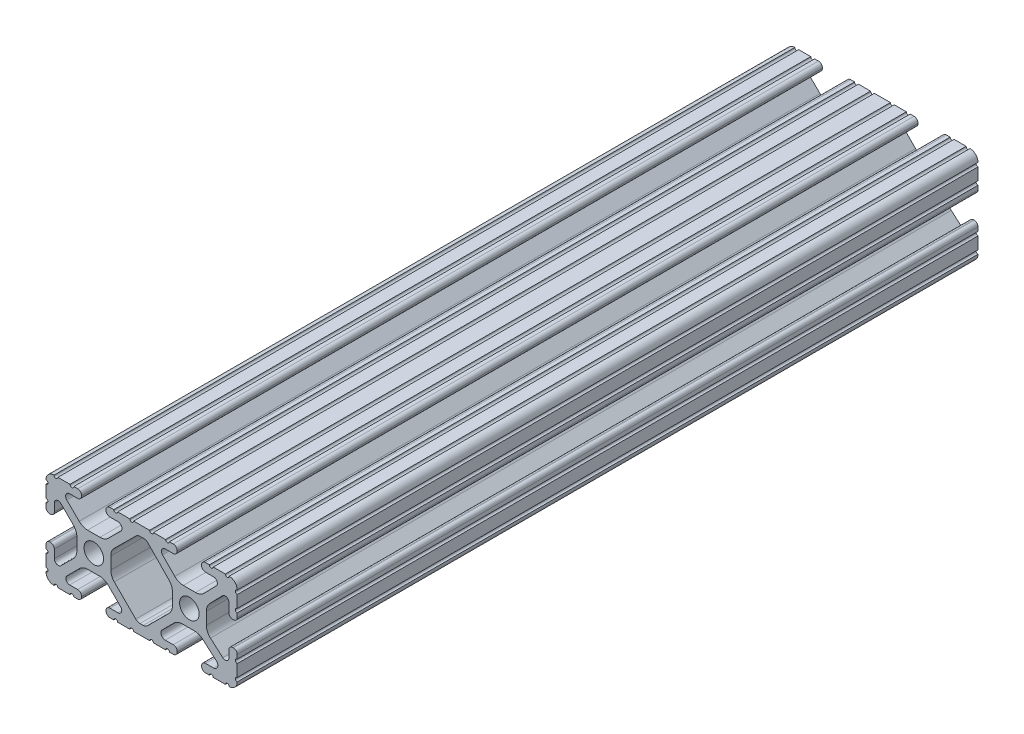
from build123d import *

# Parameters (mm, degrees)
SKETCH1_R           = 2.6035
BOSS_EXTRUDE1_DEPTH = 98.425


with BuildPart() as part:
    # Sketch1 → Boss-Extrude1 (new, symmetric)
    with BuildSketch(Plane.XY):
        with BuildLine():
            Line((18.01710265, 12.7), (16.98745015, 12.7))
            ThreePointArc((16.98745015, 12.7), (16.245730386, 12.392769614), (15.9385, 11.65104985))
            Line((15.9385, 11.65104985), (15.9385, 11.53922))
            ThreePointArc((15.9385, 11.53922), (16.245750844, 10.797450844), (16.98752, 10.4902))
            Line((16.98752, 10.4902), (19.116384363, 10.4902))
            ThreePointArc((19.116384363, 10.4902), (20.052502933, 9.869096983), (19.844087081, 8.765172272))
            Line((19.844087081, 8.765172272), (16.618993479, 5.455112286))
            ThreePointArc((16.618993479, 5.455112286), (15.578994274, 4.745442459), (14.344932584, 4.4958))
            Line((14.344932584, 4.4958), (11.083317835, 4.4958))
            ThreePointArc((11.083317835, 4.4958), (9.854330953, 4.743306833), (8.816955189, 5.447238587))
            Line((8.816955189, 5.447238587), (5.564154119, 8.762652677))
            ThreePointArc((5.564154119, 8.762652677), (5.352591412, 9.867473037), (6.289393385, 10.4902))
            Line((6.289393385, 10.4902), (8.41248, 10.4902))
            ThreePointArc((8.41248, 10.4902), (9.154249156, 10.797450844), (9.4615, 11.53922))
            Line((9.4615, 11.53922), (9.4615, 11.65104985))
            ThreePointArc((9.4615, 11.65104985), (9.154269614, 12.392769614), (8.41254985, 12.7))
            Line((8.41254985, 12.7), (7.38288465, 12.7))
            ThreePointArc((7.38288465, 12.7), (6.87488465, 12.192), (6.36688465, 12.7))
            Line((6.36688465, 12.7), (3.14958095, 12.7))
            ThreePointArc((3.14958095, 12.7), (2.64158095, 12.192), (2.13358095, 12.7))
            Line((2.13358095, 12.7), (-2.13358095, 12.7))
            ThreePointArc((-2.13358095, 12.7), (-2.64158095, 12.192), (-3.14958095, 12.7))
            Line((-3.14958095, 12.7), (-6.36689735, 12.7))
            ThreePointArc((-6.36689735, 12.7), (-6.87489735, 12.192), (-7.38289735, 12.7))
            Line((-7.38289735, 12.7), (-8.41254985, 12.7))
            ThreePointArc((-8.41254985, 12.7), (-9.154269614, 12.392769614), (-9.4615, 11.65104985))
            Line((-9.4615, 11.65104985), (-9.4615, 11.53922))
            ThreePointArc((-9.4615, 11.53922), (-9.154249156, 10.797450844), (-8.41248, 10.4902))
            Line((-8.41248, 10.4902), (-6.283641037, 10.4902))
            ThreePointArc((-6.283641037, 10.4902), (-5.297291557, 9.829633109), (-5.532576693, 8.666071843))
            Line((-5.532576693, 8.666071843), (-8.809985098, 5.416263103))
            ThreePointArc((-8.809985098, 5.416263103), (-9.836720513, 4.734920264), (-11.045536121, 4.4958))
            Line((-11.045536121, 4.4958), (-14.354463879, 4.4958))
            ThreePointArc((-14.354463879, 4.4958), (-15.563279487, 4.734920264), (-16.590014902, 5.416263103))
            Line((-16.590014902, 5.416263103), (-19.867423307, 8.666071843))
            ThreePointArc((-19.867423307, 8.666071843), (-20.102708443, 9.829633109), (-19.116358963, 10.4902))
            Line((-19.116358963, 10.4902), (-16.98752, 10.4902))
            ThreePointArc((-16.98752, 10.4902), (-16.245750844, 10.797450844), (-15.9385, 11.53922))
            Line((-15.9385, 11.53922), (-15.9385, 11.65104985))
            ThreePointArc((-15.9385, 11.65104985), (-16.245730386, 12.392769614), (-16.98745015, 12.7))
            Line((-16.98745015, 12.7), (-18.01711535, 12.7))
            ThreePointArc((-18.01711535, 12.7), (-18.52511535, 12.192), (-19.03311535, 12.7))
            Line((-19.03311535, 12.7), (-22.2504, 12.7))
            ThreePointArc((-22.2504, 12.7), (-22.758323491, 12.192000006), (-23.266399977, 12.699846982))
            ThreePointArc((-23.266399977, 12.699846982), (-24.782522516, 12.082522516), (-25.399846982, 10.566399977))
            ThreePointArc((-25.399846982, 10.566399977), (-24.892000006, 10.058323491), (-25.4, 9.5504))
            Line((-25.4, 9.5504), (-25.4, 6.3330836))
            ThreePointArc((-25.4, 6.3330836), (-24.892, 5.8250836), (-25.4, 5.3170836))
            Line((-25.4, 5.3170836), (-25.4, 4.237520184))
            ThreePointArc((-25.4, 4.237520184), (-25.107393763, 3.531106237), (-24.400979816, 3.2385))
            Line((-24.400979816, 3.2385), (-24.23922, 3.2385))
            ThreePointArc((-24.23922, 3.2385), (-23.497450844, 3.545750844), (-23.1902, 4.28752))
            Line((-23.1902, 4.28752), (-23.1902, 6.334741132))
            ThreePointArc((-23.1902, 6.334741132), (-22.556026952, 7.286023527), (-21.434002553, 7.066535717))
            Line((-21.434002553, 7.066535717), (-18.147950853, 3.808156468))
            ThreePointArc((-18.147950853, 3.808156468), (-17.452759693, 2.774838327), (-17.208501877, 1.553619571))
            Line((-17.208501877, 1.553619571), (-17.208501877, -1.695179196))
            ThreePointArc((-17.208501877, -1.695179196), (-17.450738657, -2.911536421), (-18.140486065, -3.942289578))
            Line((-18.140486065, -3.942289578), (-21.431579576, -7.227386226))
            ThreePointArc((-21.431579576, -7.227386226), (-22.55444896, -7.449940594), (-23.1902, -6.498002195))
            Line((-23.1902, -6.498002195), (-23.1902, -4.28752))
            ThreePointArc((-23.1902, -4.28752), (-23.497450844, -3.545750844), (-24.23922, -3.2385))
            Line((-24.23922, -3.2385), (-24.35098, -3.2385))
            ThreePointArc((-24.35098, -3.2385), (-25.092749156, -3.545750844), (-25.4, -4.28752))
            Line((-25.4, -4.28752), (-25.4, -5.3171344))
            ThreePointArc((-25.4, -5.3171344), (-24.892, -5.8251344), (-25.4, -6.3331344))
            Line((-25.4, -6.3331344), (-25.4, -9.5504))
            ThreePointArc((-25.4, -9.5504), (-24.892000006, -10.058323491), (-25.399846982, -10.566399977))
            ThreePointArc((-25.399846982, -10.566399977), (-24.782522516, -12.082522516), (-23.266399977, -12.699846982))
            ThreePointArc((-23.266399977, -12.699846982), (-22.758323491, -12.192000006), (-22.2504, -12.7))
            Line((-22.2504, -12.7), (-19.03308995, -12.7))
            ThreePointArc((-19.03308995, -12.7), (-18.52508995, -12.192), (-18.01708995, -12.7))
            Line((-18.01708995, -12.7), (-16.9874692, -12.7))
            ThreePointArc((-16.9874692, -12.7), (-16.245700044, -12.392749156), (-15.9384492, -11.65098))
            Line((-15.9384492, -11.65098), (-15.9384492, -11.53922))
            ThreePointArc((-15.9384492, -11.53922), (-16.245700044, -10.797450844), (-16.9874692, -10.4902))
            Line((-16.9874692, -10.4902), (-19.116358963, -10.4902))
            ThreePointArc((-19.116358963, -10.4902), (-20.055197748, -9.862578342), (-19.834124023, -8.755124678))
            Line((-19.834124023, -8.755124678), (-16.49660751, -5.423689618))
            ThreePointArc((-16.49660751, -5.423689618), (-15.467274017, -4.736928798), (-14.253591699, -4.4958))
            Line((-14.253591699, -4.4958), (-11.146408301, -4.4958))
            ThreePointArc((-11.146408301, -4.4958), (-9.932725983, -4.736928798), (-8.90339249, -5.423689618))
            Line((-8.90339249, -5.423689618), (-5.565875977, -8.755124678))
            ThreePointArc((-5.565875977, -8.755124678), (-5.344802252, -9.862578342), (-6.283641037, -10.4902))
            Line((-6.283641037, -10.4902), (-8.4125308, -10.4902))
            ThreePointArc((-8.4125308, -10.4902), (-9.154299956, -10.797450844), (-9.4615508, -11.53922))
            Line((-9.4615508, -11.53922), (-9.4615508, -11.65098))
            ThreePointArc((-9.4615508, -11.65098), (-9.154299956, -12.392749156), (-8.4125308, -12.7))
            Line((-8.4125308, -12.7), (-7.38287195, -12.7))
            ThreePointArc((-7.38287195, -12.7), (-6.87487195, -12.192), (-6.36687195, -12.7))
            Line((-6.36687195, -12.7), (-3.14960635, -12.7))
            ThreePointArc((-3.14960635, -12.7), (-2.64160635, -12.192), (-2.13360635, -12.7))
            Line((-2.13360635, -12.7), (2.13360635, -12.7))
            ThreePointArc((2.13360635, -12.7), (2.64159365, -12.1920127), (3.14958095, -12.7))
            Line((3.14958095, -12.7), (6.36691005, -12.7))
            ThreePointArc((6.36691005, -12.7), (6.87491005, -12.192), (7.38291005, -12.7))
            Line((7.38291005, -12.7), (8.4125308, -12.7))
            ThreePointArc((8.4125308, -12.7), (9.154299956, -12.392749156), (9.4615508, -11.65098))
            Line((9.4615508, -11.65098), (9.4615508, -11.53922))
            ThreePointArc((9.4615508, -11.53922), (9.154299956, -10.797450844), (8.4125308, -10.4902))
            Line((8.4125308, -10.4902), (6.289393385, -10.4902))
            ThreePointArc((6.289393385, -10.4902), (5.231590322, -9.783049717), (5.480677245, -8.535265862))
            Line((5.480677245, -8.535265862), (8.597933595, -5.423689618))
            ThreePointArc((8.597933595, -5.423689618), (9.627267088, -4.736928798), (10.840949406, -4.4958))
            Line((10.840949406, -4.4958), (14.102564155, -4.4958))
            ThreePointArc((14.102564155, -4.4958), (15.215927525, -4.697410182), (16.187895372, -5.276636531))
            Line((16.187895372, -5.276636531), (19.868247549, -8.482246082))
            ThreePointArc((19.868247549, -8.482246082), (20.188435806, -9.746879864), (19.116384363, -10.4902))
            Line((19.116384363, -10.4902), (16.9874692, -10.4902))
            ThreePointArc((16.9874692, -10.4902), (16.245700044, -10.797450844), (15.9384492, -11.53922))
            Line((15.9384492, -11.53922), (15.9384492, -11.65098))
            ThreePointArc((15.9384492, -11.65098), (16.245700044, -12.392749156), (16.9874692, -12.7))
            Line((16.9874692, -12.7), (18.01710265, -12.7))
            ThreePointArc((18.01710265, -12.7), (18.52510265, -12.192), (19.03310265, -12.7))
            Line((19.03310265, -12.7), (22.2504, -12.7))
            ThreePointArc((22.2504, -12.7), (22.758323491, -12.192000006), (23.266399977, -12.699846982))
            ThreePointArc((23.266399977, -12.699846982), (24.782522516, -12.082522516), (25.399846982, -10.566399977))
            ThreePointArc((25.399846982, -10.566399977), (24.892000006, -10.058323492), (25.4, -9.550400001))
            Line((25.4, -9.550400001), (25.4, -6.333083592))
            ThreePointArc((25.4, -6.333083592), (24.892000001, -5.825083593), (25.4, -5.317083593))
            Line((25.4, -5.317083593), (25.4, -4.237520184))
            ThreePointArc((25.4, -4.237520184), (25.107393763, -3.531106237), (24.400979816, -3.2385))
            Line((24.400979816, -3.2385), (24.189220184, -3.2385))
            ThreePointArc((24.189220184, -3.2385), (23.482806237, -3.531106237), (23.1902, -4.237520184))
            Line((23.1902, -4.237520184), (23.1902, -6.155876159))
            ThreePointArc((23.1902, -6.155876159), (22.62232736, -7.038258539), (21.583974541, -6.886926384))
            Line((21.583974541, -6.886926384), (18.29817066, -4.024970844))
            ThreePointArc((18.29817066, -4.024970844), (17.493730985, -2.946044689), (17.208501877, -1.630807374))
            Line((17.208501877, -1.630807374), (17.208501877, 1.630807374))
            ThreePointArc((17.208501877, 1.630807374), (17.442348332, 2.82673414), (18.109440981, 3.846495088))
            Line((18.109440981, 3.846495088), (21.526346532, 7.353420386))
            ThreePointArc((21.526346532, 7.353420386), (22.585896263, 7.574939077), (23.1902, 6.676867167))
            Line((23.1902, 6.676867167), (23.1902, 4.237520184))
            ThreePointArc((23.1902, 4.237520184), (23.482806237, 3.531106237), (24.189220184, 3.2385))
            Line((24.189220184, 3.2385), (24.400979816, 3.2385))
            ThreePointArc((24.400979816, 3.2385), (25.107393763, 3.531106237), (25.4, 4.237520184))
            Line((25.4, 4.237520184), (25.4, 5.3170836))
            ThreePointArc((25.4, 5.3170836), (24.891949193, 5.825134407), (25.4, 6.333185215))
            Line((25.4, 6.333185215), (25.4, 9.550400015))
            ThreePointArc((25.4, 9.550400015), (24.892000013, 10.058323498), (25.399846982, 10.566399977))
            ThreePointArc((25.399846982, 10.566399977), (24.782522516, 12.082522516), (23.266399977, 12.699846982))
            ThreePointArc((23.266399977, 12.699846982), (22.758323491, 12.192000006), (22.2504, 12.7))
            Line((22.2504, 12.7), (19.03310265, 12.7))
            ThreePointArc((19.03310265, 12.7), (18.52510265, 12.192), (18.01710265, 12.7))
        make_face()
        with Locations((-12.7, 0)):
            Circle(SKETCH1_R, mode=Mode.SUBTRACT)
        with Locations((12.7, 0)):
            Circle(SKETCH1_R, mode=Mode.SUBTRACT)
        with BuildLine():
            Line((-7.259513935, -3.869413038), (-1.545748891, -9.572766749))
            ThreePointArc((-1.545748891, -9.572766749), (-1.035199478, -9.913400116), (-0.433213048, -10.033))
            Line((-0.433213048, -10.033), (0.433213048, -10.033))
            ThreePointArc((0.433213048, -10.033), (1.035199478, -9.913400116), (1.545748891, -9.572766749))
            Line((1.545748891, -9.572766749), (7.259513935, -3.869413038))
            ThreePointArc((7.259513935, -3.869413038), (7.949261343, -2.838659881), (8.191498123, -1.622302656))
            Line((8.191498123, -1.622302656), (8.191498123, 1.622302656))
            ThreePointArc((8.191498123, 1.622302656), (7.955573352, 2.823327967), (7.282860769, 3.845864069))
            Line((7.282860769, 3.845864069), (1.675572808, 9.561086461))
            ThreePointArc((1.675572808, 9.561086461), (1.161034429, 9.910236611), (0.551456936, 10.033))
            Line((0.551456936, 10.033), (-0.395199982, 10.033))
            ThreePointArc((-0.395199982, 10.033), (-0.994772524, 9.914396349), (-1.50403329, 9.576450301))
            Line((-1.50403329, 9.576450301), (-7.252049147, 3.876839553))
            ThreePointArc((-7.252049147, 3.876839553), (-7.947240307, 2.843521412), (-8.191498123, 1.622302656))
            Line((-8.191498123, 1.622302656), (-8.191498123, -1.622302656))
            ThreePointArc((-8.191498123, -1.622302656), (-7.949261343, -2.838659881), (-7.259513935, -3.869413038))
        make_face(mode=Mode.SUBTRACT)
    extrude(amount=BOSS_EXTRUDE1_DEPTH, both=True)


solid = part.part
